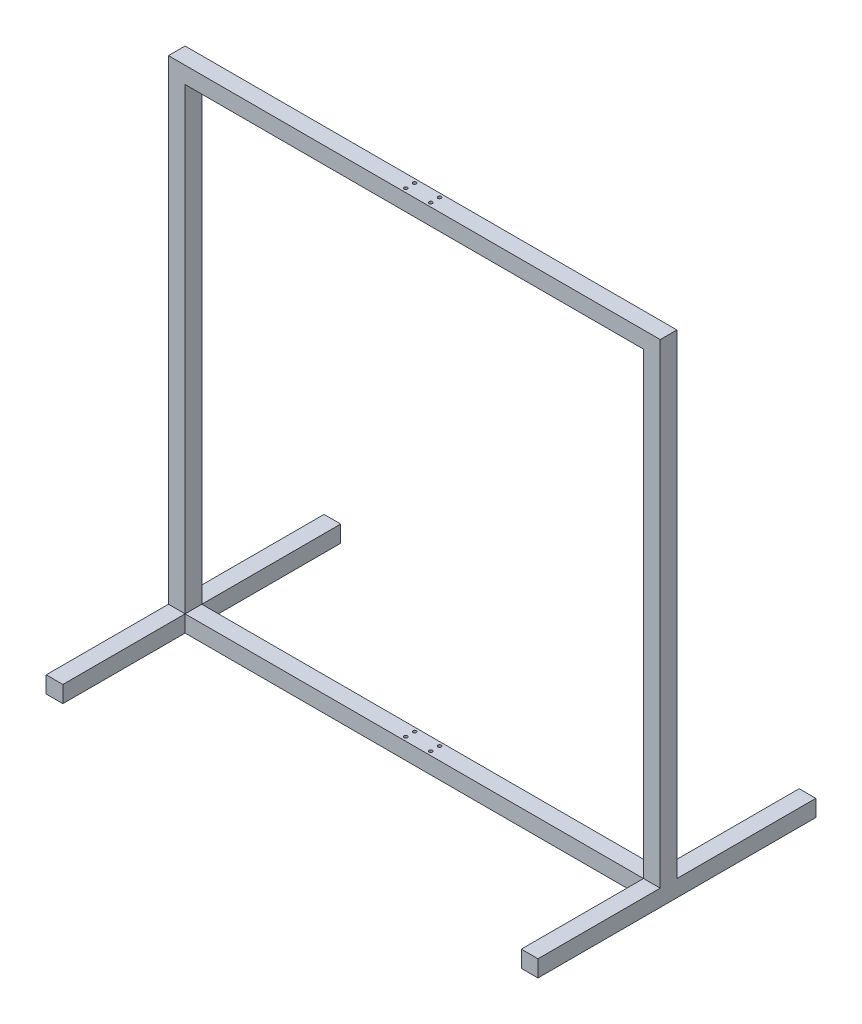
from build123d import *

# Parameters (mm, degrees)
BOSS_EXTRUDE2_DEPTH     = 60
SKETCH2_W               = 60
SKETCH2_H               = 60
BOSS_EXTRUDE3_DEPTH     = 500
SKETCH4_W               = 60
SKETCH4_H               = 60
BOSS_EXTRUDE4_DEPTH     = 1703
CUT_EXTRUDE2_DEPTH      = 1990.302641631
CUT_EXTRUDE2_DEPTH_BACK = 298
SKETCH5_R               = 6


with BuildPart() as part:
    # Sketch1 → Boss-Extrude2 (new body)
    with BuildSketch(Plane.XY):
        Polygon((885, 885), (885, -885), (825, -885), (825, -825), (825, 825), (-825, 825), (-825, -825), (-825, -885), (-885, -885), (-885, 885), align=None)
    extrude(amount=BOSS_EXTRUDE2_DEPTH)

    # Sketch2 → Boss-Extrude3 (add, symmetric)
    with BuildSketch(Plane.XY):
        with Locations((-855, -855)):
            Rectangle(SKETCH2_W, SKETCH2_H)
        with Locations((855, -855)):
            Rectangle(SKETCH2_W, SKETCH2_H)
    extrude(amount=BOSS_EXTRUDE3_DEPTH, both=True)

    # Sketch4 → Boss-Extrude4 (add)
    with BuildSketch(Plane(origin=(-825, 0, 0), x_dir=(0, 0, -1), z_dir=(1, 0, 0))):
        with Locations((-30, -855)):
            Rectangle(SKETCH4_W, SKETCH4_H)
    extrude(amount=BOSS_EXTRUDE4_DEPTH)

    # Sketch5 → Cut-Extrude2 (cut, two sides: drawn at the far end of the back side and taken through both)
    with BuildSketch(Plane.XZ.offset(-825).offset(-CUT_EXTRUDE2_DEPTH_BACK)):
        with Locations(Location((-45, 46, 0), (0, 0, 270))):
            Circle(SKETCH5_R)
        with Locations(Location((-45, 14, 0), (0, 0, 270))):
            Circle(SKETCH5_R)
        with Locations(Location((45, 46, 0), (0, 0, 270))):
            Circle(SKETCH5_R)
        with Locations(Location((45, 14, 0), (0, 0, 270))):
            Circle(SKETCH5_R)
    extrude(amount=CUT_EXTRUDE2_DEPTH + CUT_EXTRUDE2_DEPTH_BACK, mode=Mode.SUBTRACT)


solid = part.part
